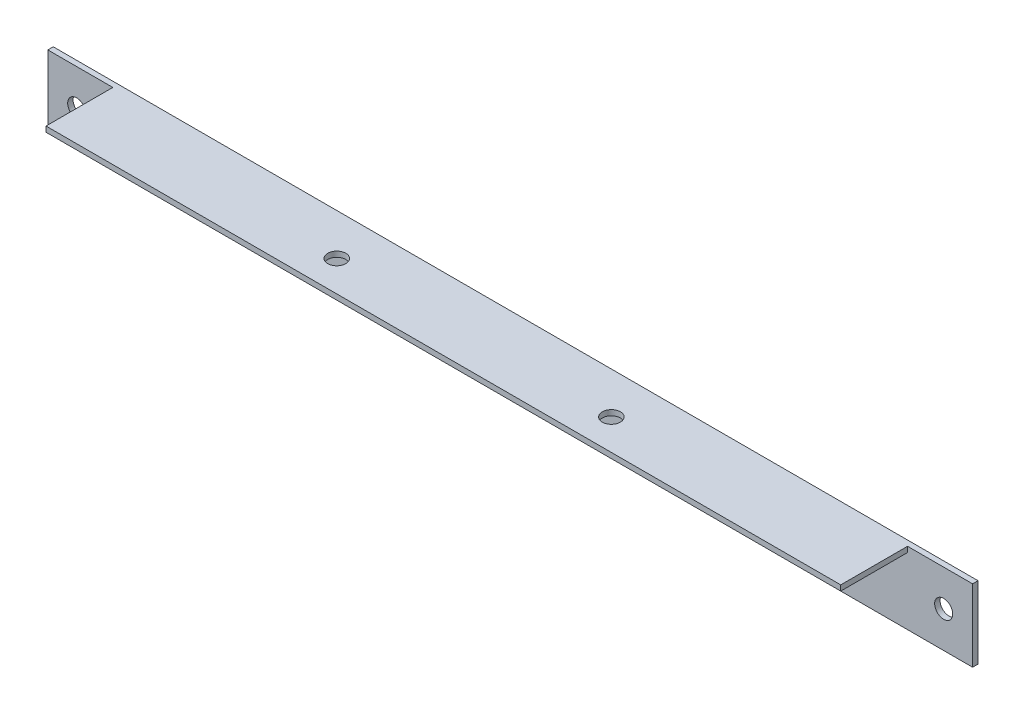
from build123d import *

# Parameters (mm, degrees)
EXTRU_MINCE1_DEPTH      = 128
ESQUISSE2_R             = 2.5
ENL_V_MAT_EXTRU_1_DEPTH = 10
ESQUISSE3_R             = 2.5
ESQUISSE3_W             = 18
ESQUISSE3_H             = 18.5
ENL_V_MAT_EXTRU_2_DEPTH = 10


with BuildPart() as part:
    # Esquisse1 → Extru.-Mince1 (new, symmetric)
    with BuildSketch(Plane(origin=(0, 0, 0), x_dir=(0, 0, -1), z_dir=(1, 0, 0))):
        Polygon((-20, 0), (0, 0), (0, -20), (-1.5, -20), (-1.5, -1.5), (-20, -1.5), align=None)
    extrude(amount=EXTRU_MINCE1_DEPTH, both=True)

    # Esquisse2 → Enlèv. mat.-Extru.1 (cut)
    with BuildSketch(Plane.XY.offset(1.5)):
        with Locations((-120, -10)):
            Circle(ESQUISSE2_R)
        with Locations(Location((120, -10, 0), (0, 0, 90))):
            Circle(ESQUISSE2_R)
    extrude(amount=-ENL_V_MAT_EXTRU_1_DEPTH, mode=Mode.SUBTRACT)

    # Esquisse3 → Enlèv. mat.-Extru.2 (cut)
    with BuildSketch(Plane.XZ.offset(1.5)):
        with Locations(Location((-38, 11.5, 0), (0, 0, 270))):
            Circle(ESQUISSE3_R)
        with Locations(Location((38, 11.5, 0), (0, 0, 90))):
            Circle(ESQUISSE3_R)
        with Locations((-119, 10.75)):
            Rectangle(ESQUISSE3_W, ESQUISSE3_H)
        with Locations((119, 10.75)):
            Rectangle(ESQUISSE3_W, ESQUISSE3_H)
    extrude(amount=-ENL_V_MAT_EXTRU_2_DEPTH, mode=Mode.SUBTRACT)


solid = part.part
